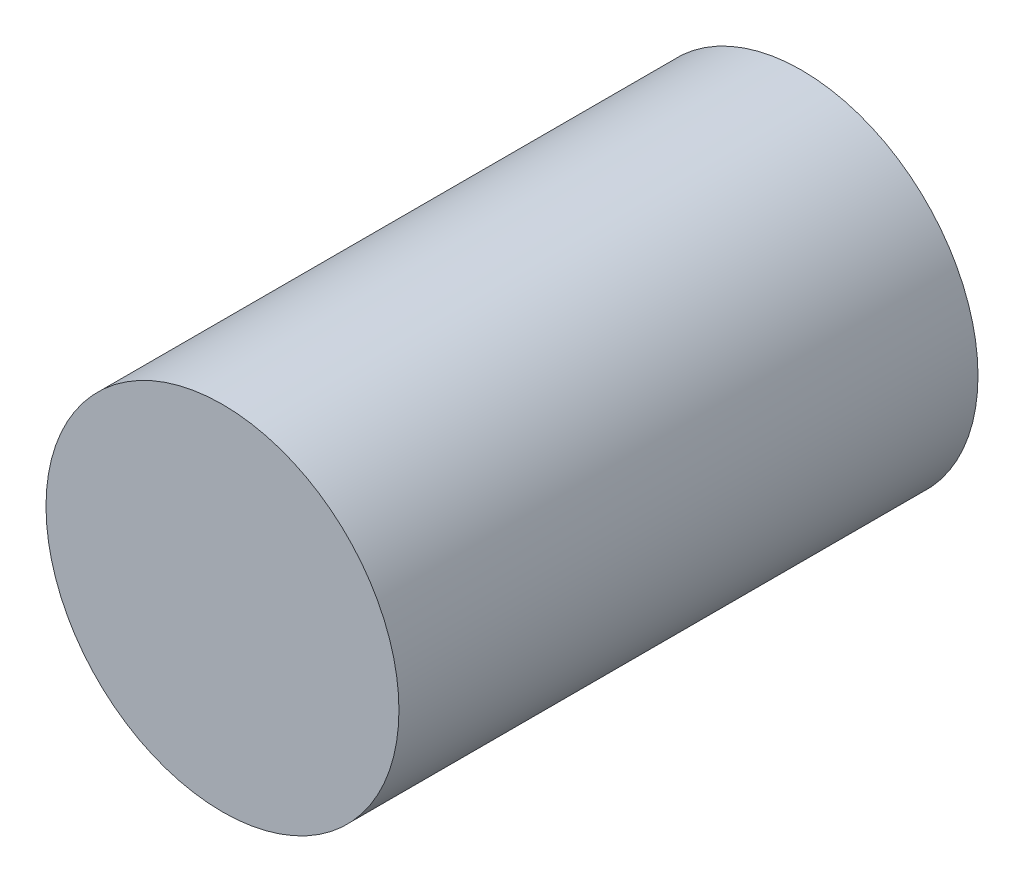
from build123d import *

# Parameters (mm, degrees)
CROQUIS1_R              = 6.4
SALIENTE_EXTRUIR1_DEPTH = 21


with BuildPart() as part:
    # Croquis1 → Saliente-Extruir1 (new body)
    with BuildSketch(Plane.XY):
        with Locations(Location((0, 0, 0), (0, 0, 180))):
            Circle(CROQUIS1_R)
    extrude(amount=SALIENTE_EXTRUIR1_DEPTH)


solid = part.part
